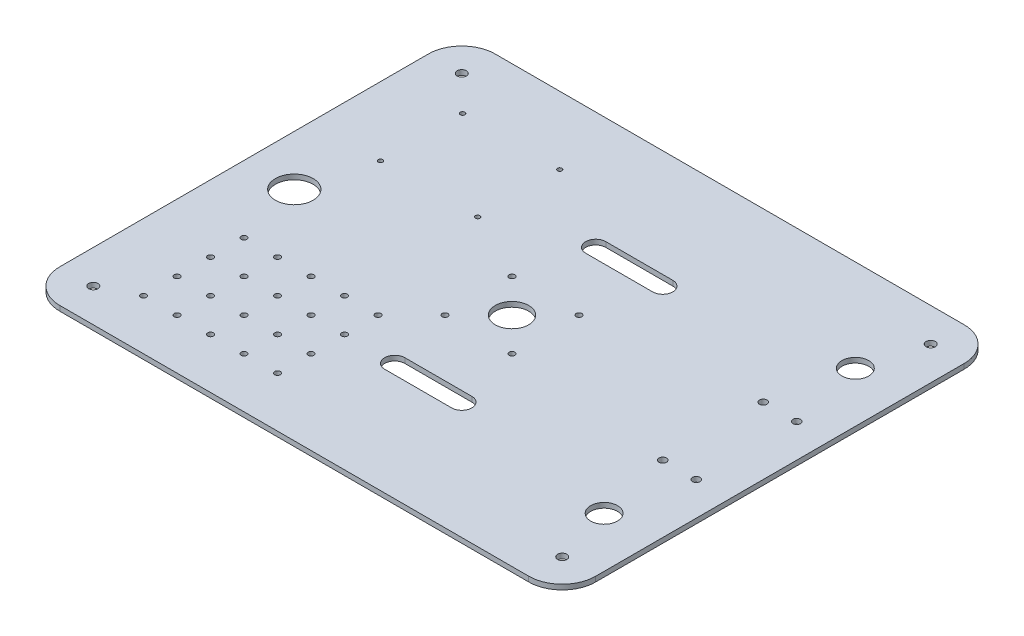
from build123d import *

# Parameters (mm, degrees)
DECK_DEPTH                          = 3
CUT_DECKPOSTS_M5_DEPTH              = 207.177108332
CUT_DECKPOSTS_M5_DEPTH_BACK         = 207.177108332
SK_DECKPOSTS_M5_R                   = 2.75
CUT_LIDARMOUNT_DEPTH                = 207.177108332
CUT_LIDARMOUNT_DEPTH_BACK           = 207.177108332
SK_LIDARMOUNT_R                     = 1.7
SK_LIDARMOUNT_R_2                   = 10
CUT_PI5_M2P5_DEPTH                  = 207.177108332
CUT_PI5_M2P5_DEPTH_BACK             = 207.177108332
SK_PI5_M2P5_R                       = 1.35
CUT_DECKGRID_M3_DEPTH               = 207.177108332
CUT_DECKGRID_M3_DEPTH_BACK          = 207.177108332
SK_DECKGRID_M3_R                    = 1.7
CUT_ESTOP_22MM_DEPTH                = 207.177108332
CUT_ESTOP_22MM_DEPTH_BACK           = 207.177108332
SK_ESTOP_22MM_R                     = 11.25
CUT_CAMERAMOUNT_M4_DEPTH            = 207.177108332
CUT_CAMERAMOUNT_M4_DEPTH_BACK       = 207.177108332
SK_CAMERAMOUNT_M4_R                 = 2.25
CUT_INDICATORLIGHTS_16MM_DEPTH      = 207.177108332
CUT_INDICATORLIGHTS_16MM_DEPTH_BACK = 207.177108332
SK_INDICATORLIGHTS_R                = 8
CUT_DECKPASSTHRU_DEPTH              = 207.177108332
CUT_DECKPASSTHRU_DEPTH_BACK         = 207.177108332


with BuildPart() as part:
    # SK_Deck → Deck (new body)
    with BuildSketch(Plane(origin=(0, 0, 0), x_dir=(1, 0, 0), z_dir=(0, 1, 0))):
        with BuildLine():
            Line((160, -110), (160, 110))
            ThreePointArc((160, 110), (154.142135624, 124.142135624), (140, 130))
            Line((140, 130), (-140, 130))
            ThreePointArc((-140, 130), (-154.142135624, 124.142135624), (-160, 110))
            Line((-160, 110), (-160, -110))
            ThreePointArc((-160, -110), (-154.142135624, -124.142135624), (-140, -130))
            Line((-140, -130), (140, -130))
            ThreePointArc((140, -130), (154.142135624, -124.142135624), (160, -110))
        make_face()
    extrude(amount=DECK_DEPTH)

    # SK_DeckPosts_M5 → Cut_DeckPosts_M5 (cut, two sides: drawn at the far end of the back side and taken through both)
    with BuildSketch(Plane(origin=(0, 0, 0), x_dir=(1, 0, 0), z_dir=(0, 1, 0)).offset(-CUT_DECKPOSTS_M5_DEPTH_BACK)):
        with Locations(Location((140, 110, 0), (0, 0, 270))):
            Circle(SK_DECKPOSTS_M5_R)
        with Locations(Location((140, -110, 0), (0, 0, 270))):
            Circle(SK_DECKPOSTS_M5_R)
        with Locations(Location((-140, 110, 0), (0, 0, 270))):
            Circle(SK_DECKPOSTS_M5_R)
        with Locations(Location((-140, -110, 0), (0, 0, 270))):
            Circle(SK_DECKPOSTS_M5_R)
    extrude(amount=CUT_DECKPOSTS_M5_DEPTH + CUT_DECKPOSTS_M5_DEPTH_BACK, mode=Mode.SUBTRACT)

    # SK_LidarMount → Cut_LidarMount (cut, two sides: drawn at the far end of the back side and taken through both)
    with BuildSketch(Plane(origin=(0, 0, 0), x_dir=(1, 0, 0), z_dir=(0, 1, 0)).offset(-CUT_LIDARMOUNT_DEPTH_BACK)):
        with Locations(Location((20, 20, 0), (0, 0, 270))):
            Circle(SK_LIDARMOUNT_R)
        with Locations(Location((20, -20, 0), (0, 0, 270))):
            Circle(SK_LIDARMOUNT_R)
        with Locations(Location((-20, 20, 0), (0, 0, 270))):
            Circle(SK_LIDARMOUNT_R)
        with Locations(Location((-20, -20, 0), (0, 0, 270))):
            Circle(SK_LIDARMOUNT_R)
        with Locations(Location((0, 0, 0), (0, 0, 270))):
            Circle(SK_LIDARMOUNT_R_2)
    extrude(amount=CUT_LIDARMOUNT_DEPTH + CUT_LIDARMOUNT_DEPTH_BACK, mode=Mode.SUBTRACT)

    # SK_Pi5_M2p5 → Cut_Pi5_M2p5 (cut, two sides: drawn at the far end of the back side and taken through both)
    with BuildSketch(Plane(origin=(0, 0, 0), x_dir=(1, 0, 0), z_dir=(0, 1, 0)).offset(-CUT_PI5_M2P5_DEPTH_BACK)):
        with Locations(Location((-119, 40.5, 0), (0, 0, 270))):
            Circle(SK_PI5_M2P5_R)
        with Locations(Location((-119, 89.5, 0), (0, 0, 270))):
            Circle(SK_PI5_M2P5_R)
        with Locations(Location((-61, 40.5, 0), (0, 0, 270))):
            Circle(SK_PI5_M2P5_R)
        with Locations(Location((-61, 89.5, 0), (0, 0, 270))):
            Circle(SK_PI5_M2P5_R)
    extrude(amount=CUT_PI5_M2P5_DEPTH + CUT_PI5_M2P5_DEPTH_BACK, mode=Mode.SUBTRACT)

    # SK_DeckGrid_M3 → Cut_DeckGrid_M3 (cut, two sides: drawn at the far end of the back side and taken through both)
    with BuildSketch(Plane(origin=(0, 0, 0), x_dir=(1, 0, 0), z_dir=(0, 1, 0)).offset(-CUT_DECKGRID_M3_DEPTH_BACK)):
        with Locations(Location((-120, -40, 0), (0, 0, 270))):
            Circle(SK_DECKGRID_M3_R)
        with Locations(Location((-120, -60, 0), (0, 0, 270))):
            Circle(SK_DECKGRID_M3_R)
        with Locations(Location((-120, -80, 0), (0, 0, 270))):
            Circle(SK_DECKGRID_M3_R)
        with Locations(Location((-120, -100, 0), (0, 0, 270))):
            Circle(SK_DECKGRID_M3_R)
        with Locations(Location((-100, -40, 0), (0, 0, 270))):
            Circle(SK_DECKGRID_M3_R)
        with Locations(Location((-100, -60, 0), (0, 0, 270))):
            Circle(SK_DECKGRID_M3_R)
        with Locations(Location((-100, -80, 0), (0, 0, 270))):
            Circle(SK_DECKGRID_M3_R)
        with Locations(Location((-100, -100, 0), (0, 0, 270))):
            Circle(SK_DECKGRID_M3_R)
        with Locations(Location((-80, -40, 0), (0, 0, 270))):
            Circle(SK_DECKGRID_M3_R)
        with Locations(Location((-80, -60, 0), (0, 0, 270))):
            Circle(SK_DECKGRID_M3_R)
        with Locations(Location((-80, -80, 0), (0, 0, 270))):
            Circle(SK_DECKGRID_M3_R)
        with Locations(Location((-80, -100, 0), (0, 0, 270))):
            Circle(SK_DECKGRID_M3_R)
        with Locations(Location((-60, -40, 0), (0, 0, 270))):
            Circle(SK_DECKGRID_M3_R)
        with Locations(Location((-60, -60, 0), (0, 0, 270))):
            Circle(SK_DECKGRID_M3_R)
        with Locations(Location((-60, -80, 0), (0, 0, 270))):
            Circle(SK_DECKGRID_M3_R)
        with Locations(Location((-60, -100, 0), (0, 0, 270))):
            Circle(SK_DECKGRID_M3_R)
        with Locations(Location((-40, -40, 0), (0, 0, 270))):
            Circle(SK_DECKGRID_M3_R)
        with Locations(Location((-40, -60, 0), (0, 0, 270))):
            Circle(SK_DECKGRID_M3_R)
        with Locations(Location((-40, -80, 0), (0, 0, 270))):
            Circle(SK_DECKGRID_M3_R)
        with Locations(Location((-40, -100, 0), (0, 0, 270))):
            Circle(SK_DECKGRID_M3_R)
    extrude(amount=CUT_DECKGRID_M3_DEPTH + CUT_DECKGRID_M3_DEPTH_BACK, mode=Mode.SUBTRACT)

    # SK_EStop_22mm → Cut_EStop_22mm (cut, two sides: drawn at the far end of the back side and taken through both)
    with BuildSketch(Plane(origin=(0, 0, 0), x_dir=(1, 0, 0), z_dir=(0, 1, 0)).offset(-CUT_ESTOP_22MM_DEPTH_BACK)):
        with Locations(Location((-130, 0, 0), (0, 0, 270))):
            Circle(SK_ESTOP_22MM_R)
    extrude(amount=CUT_ESTOP_22MM_DEPTH + CUT_ESTOP_22MM_DEPTH_BACK, mode=Mode.SUBTRACT)

    # SK_CameraMount_M4 → Cut_CameraMount_M4 (cut, two sides: drawn at the far end of the back side and taken through both)
    with BuildSketch(Plane(origin=(0, 0, 0), x_dir=(1, 0, 0), z_dir=(0, 1, 0)).offset(-CUT_CAMERAMOUNT_M4_DEPTH_BACK)):
        with Locations(Location((120, 30, 0), (0, 0, 270))):
            Circle(SK_CAMERAMOUNT_M4_R)
        with Locations(Location((120, -30, 0), (0, 0, 270))):
            Circle(SK_CAMERAMOUNT_M4_R)
        with Locations(Location((140, 30, 0), (0, 0, 270))):
            Circle(SK_CAMERAMOUNT_M4_R)
        with Locations(Location((140, -30, 0), (0, 0, 270))):
            Circle(SK_CAMERAMOUNT_M4_R)
    extrude(amount=CUT_CAMERAMOUNT_M4_DEPTH + CUT_CAMERAMOUNT_M4_DEPTH_BACK, mode=Mode.SUBTRACT)

    # SK_IndicatorLights → Cut_IndicatorLights_16mm (cut, two sides: drawn at the far end of the back side and taken through both)
    with BuildSketch(Plane(origin=(0, 0, 0), x_dir=(1, 0, 0), z_dir=(0, 1, 0)).offset(-CUT_INDICATORLIGHTS_16MM_DEPTH_BACK)):
        with Locations(Location((130, 75, 0), (0, 0, 270))):
            Circle(SK_INDICATORLIGHTS_R)
        with Locations(Location((130, -75, 0), (0, 0, 270))):
            Circle(SK_INDICATORLIGHTS_R)
    extrude(amount=CUT_INDICATORLIGHTS_16MM_DEPTH + CUT_INDICATORLIGHTS_16MM_DEPTH_BACK, mode=Mode.SUBTRACT)

    # SK_DeckPassThru → Cut_DeckPassThru (cut, two sides: drawn at the far end of the back side and taken through both)
    with BuildSketch(Plane(origin=(0, 0, 0), x_dir=(1, 0, 0), z_dir=(0, 1, 0)).offset(-CUT_DECKPASSTHRU_DEPTH_BACK)):
        with BuildLine():
            Line((-10, 66), (30, 66))
            ThreePointArc((30, 66), (36, 60), (30, 54))
            Line((30, 54), (-10, 54))
            ThreePointArc((-10, 54), (-16, 60), (-10, 66))
        make_face()
        with BuildLine():
            Line((-10, -54), (30, -54))
            ThreePointArc((30, -54), (36, -60), (30, -66))
            Line((30, -66), (-10, -66))
            ThreePointArc((-10, -66), (-16, -60), (-10, -54))
        make_face()
    extrude(amount=CUT_DECKPASSTHRU_DEPTH + CUT_DECKPASSTHRU_DEPTH_BACK, mode=Mode.SUBTRACT)


solid = part.part
